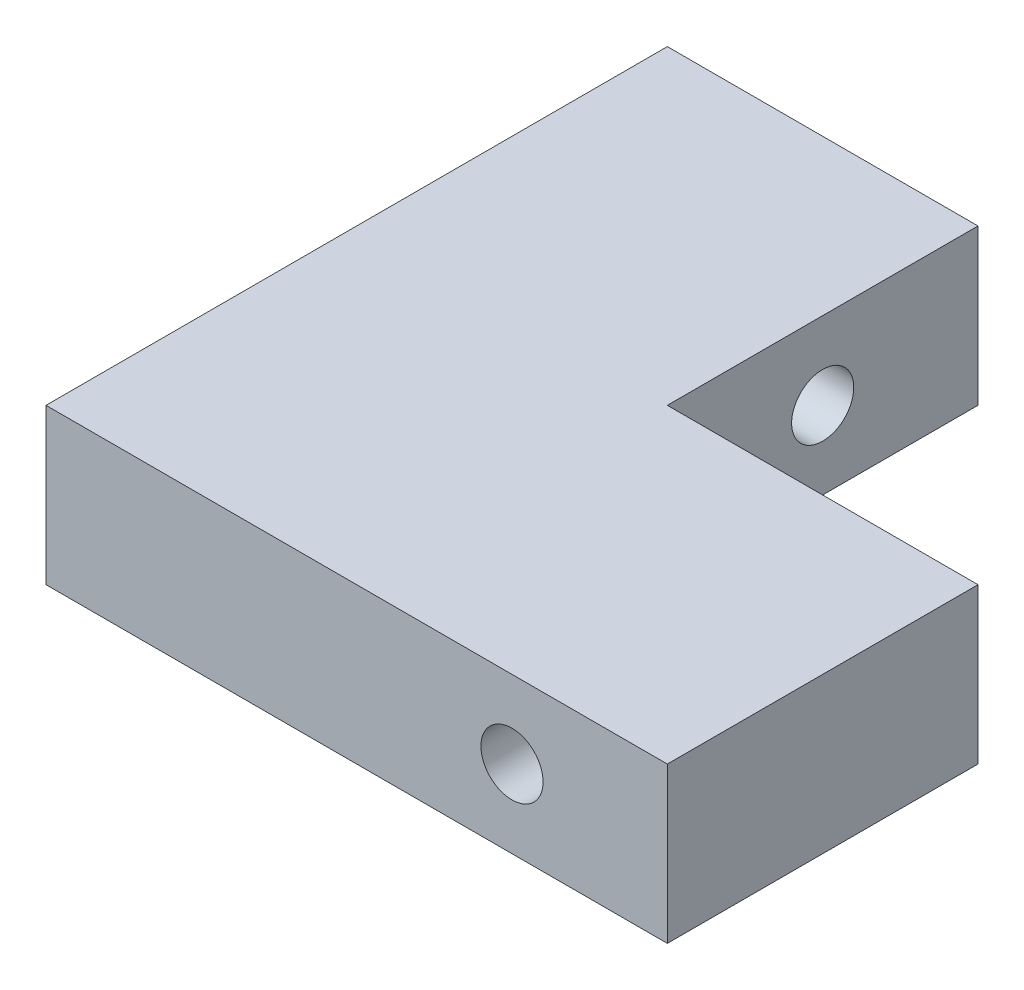
from build123d import *

# Parameters (mm, degrees)
RESSALTO_EXTRUS_O1_DEPTH = 20
ESBO_O3_R                = 4
CORTE_EXTRUS_O1_DEPTH    = 63.524475359
ESBO_O4_R                = 4
CORTE_EXTRUS_O2_DEPTH    = 84.066238629


with BuildPart() as part:
    # Esboço1 → Ressalto-extrusão1 (new body)
    with BuildSketch(Plane(origin=(0, 0, 0), x_dir=(1, 0, 0), z_dir=(0, 1, 0))):
        Polygon((-70, 36.304347826), (-70, -43.695652174), (10, -43.695652174), (10, -3.695652174), (-30, -3.695652174), (-30, 36.304347826), align=None)
    extrude(amount=RESSALTO_EXTRUS_O1_DEPTH)

    # Esboço3 → Corte-extrusão1 (cut, through all)
    with BuildSketch(Plane(origin=(-30, 0, 0), x_dir=(0, 0, -1), z_dir=(1, 0, 0))):
        with Locations((16.304347826, 10)):
            Circle(ESBO_O3_R)
    extrude(amount=-CORTE_EXTRUS_O1_DEPTH, mode=Mode.SUBTRACT)

    # Esboço4 → Corte-extrusão2 (cut, through all)
    with BuildSketch(Plane(origin=(0, 0, 3.695652174), x_dir=(-1, 0, 0), z_dir=(0, 0, -1))):
        with Locations((10, 10)):
            Circle(ESBO_O4_R)
    extrude(amount=-CORTE_EXTRUS_O2_DEPTH, mode=Mode.SUBTRACT)


solid = part.part
